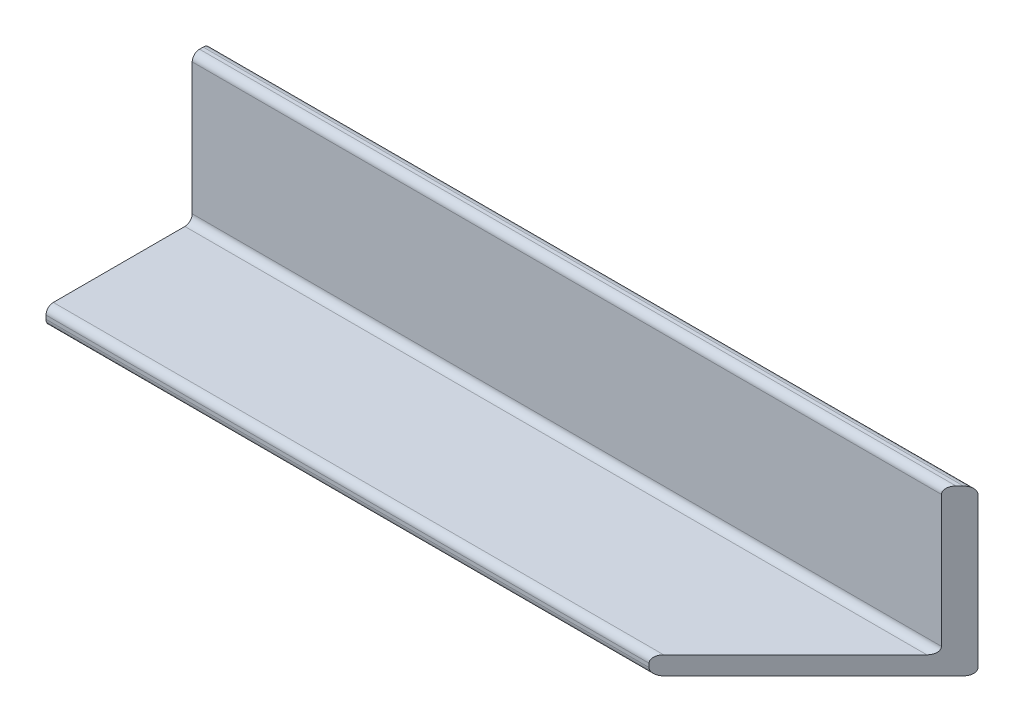
from build123d import *

# Parameters (mm, degrees)
SKETCH1_W           = 105
SKETCH1_H           = 22.5
BOSS_EXTRUDE1_DEPTH = 2.5
SKETCH2_W           = 105
SKETCH2_H           = 2.5
BOSS_EXTRUDE2_DEPTH = 20
CUT_EXTRUDE1_DEPTH  = 59.215655111
FILLET1_R           = 1


with BuildPart() as part:
    # Sketch1 → Boss-Extrude1 (new body)
    with BuildSketch(Plane(origin=(0, 0, 0), x_dir=(1, 0, 0), z_dir=(0, 1, 0))):
        Rectangle(SKETCH1_W, SKETCH1_H)
    extrude(amount=BOSS_EXTRUDE1_DEPTH)

    # Sketch2 → Boss-Extrude2 (add)
    with BuildSketch(Plane(origin=(0, 2.5, 0), x_dir=(1, 0, 0), z_dir=(0, 1, 0))):
        with Locations((0, 10)):
            Rectangle(SKETCH2_W, SKETCH2_H)
    extrude(amount=BOSS_EXTRUDE2_DEPTH)

    # Sketch3 → Cut-Extrude1 (cut, through all)
    with BuildSketch(Plane(origin=(0, 0, 0), x_dir=(-1, 0, 0), z_dir=(0, -1, 0))):
        Polygon((-52.5, -11.25), (-52.5, 11.25), (-30, -11.25), align=None)
    extrude(amount=-CUT_EXTRUDE1_DEPTH, mode=Mode.SUBTRACT)

    # Fillet1
    fillet1_edges = [part.edges().sort_by_distance(p)[0] for p in [
        (-11.25, 2.5, 11.25),
        (-1.25, 2.5, -8.75),
        (-1.25, 22.5, -8.75),
        (0, 22.5, -11.25),
        (-11.25, 0, 11.25),
        (0, 0, -11.25),
    ]]
    fillet(fillet1_edges, radius=FILLET1_R)


solid = part.part
